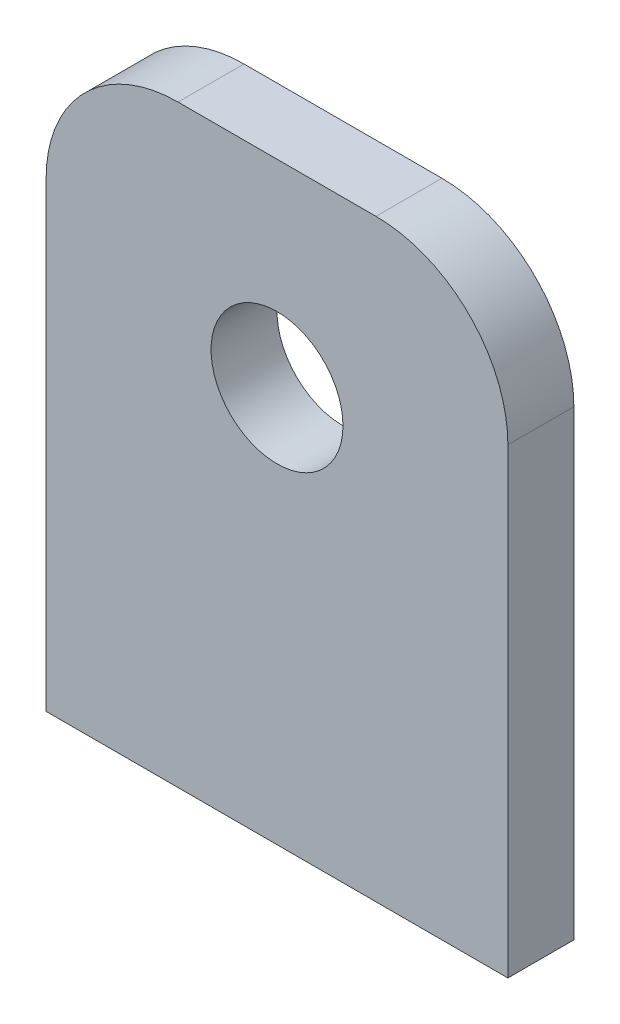
from build123d import *

# Parameters (mm, degrees)
SKETCH1_W           = 22.225
SKETCH1_H           = 28.575
BOSS_EXTRUDE1_DEPTH = 3.175
FILLET1_R           = 6.35
SKETCH2_R           = 3.175
CUT_EXTRUDE1_DEPTH  = 19.376641083


with BuildPart() as part:
    # Sketch1 → Boss-Extrude1 (new body)
    with BuildSketch(Plane.XY):
        Rectangle(SKETCH1_W, SKETCH1_H)
    extrude(amount=BOSS_EXTRUDE1_DEPTH)

    # Fillet1
    fillet1_edges = [part.edges().sort_by_distance(p)[0] for p in [
        (-11.1125, 14.2875, 1.5875),
        (11.1125, 14.2875, 1.5875),
    ]]
    fillet(fillet1_edges, radius=FILLET1_R)

    # Sketch2 → Cut-Extrude1 (cut, through all)
    with BuildSketch(Plane.XY.offset(3.175)):
        with Locations((0, 4.7625)):
            Circle(SKETCH2_R)
    extrude(amount=-CUT_EXTRUDE1_DEPTH, mode=Mode.SUBTRACT)


solid = part.part
